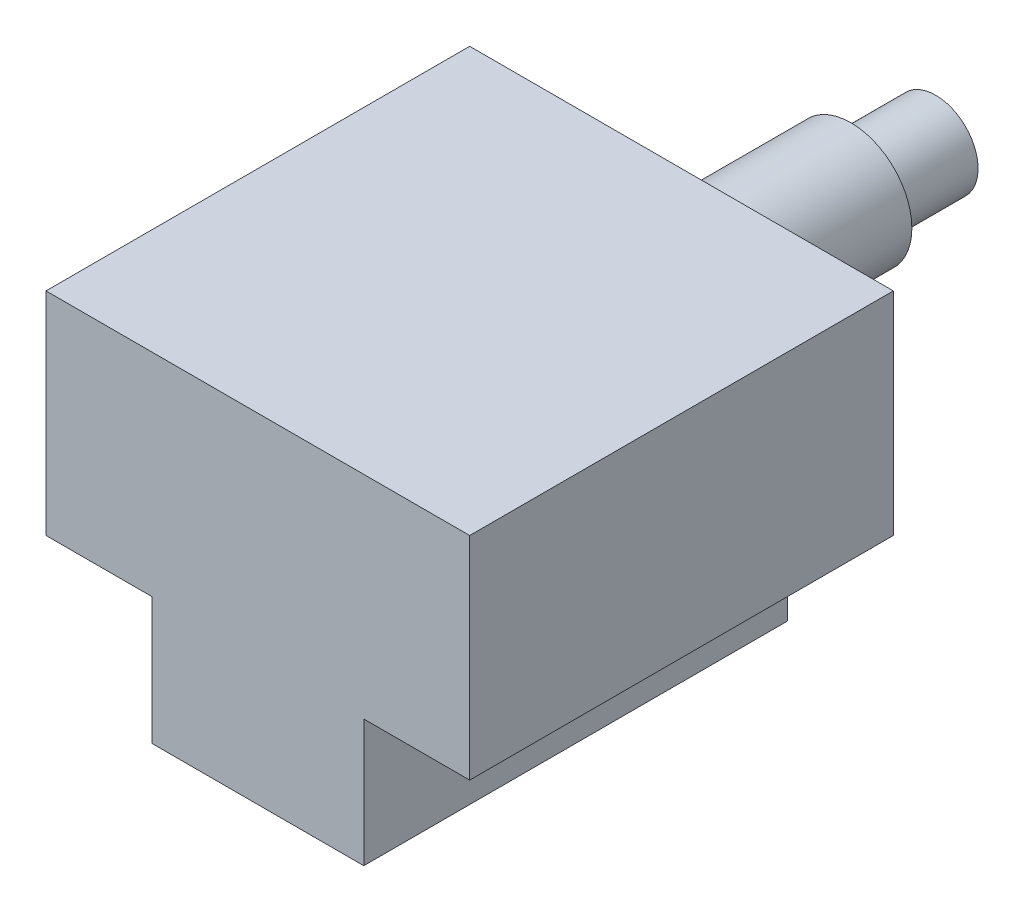
from build123d import *

# Parameters (mm, degrees)
SKETCH_1_W               = 100
SKETCH_1_H               = 50
SKETCH_1_W_2             = 50
SKETCH_1_H_2             = 30
EXTRUDE_1_DEPTH          = 50
SKETCH_2_R               = 14.373245618
EXTRUDE_2_DEPTH          = 30
CUT_EXTRUDE_2_DEPTH      = 154.378616502
CUT_EXTRUDE_2_DEPTH_BACK = 154.378616502
SKETCH_4_W               = 100
SKETCH_4_H               = 50
SKETCH_5_R               = 10
EXTRUDE_3_DEPTH          = 30
SKETCH_6_R               = 14.373245618
EXTRUDE_4_DEPTH          = 10


with BuildPart() as part:
    # 草图1 → 凸台-拉伸1 (new, symmetric)
    with BuildSketch(Plane.XY):
        Rectangle(SKETCH_1_W, SKETCH_1_H)
        with Locations((0, -40)):
            Rectangle(SKETCH_1_W_2, SKETCH_1_H_2)
        Polygon((25, -55), (-25, -55), (-50, -55), (-50, -105), (50, -105), (50, -55), align=None)
    extrude(amount=EXTRUDE_1_DEPTH, both=True)

    # 草图2 → 凸台-拉伸2 (add)
    with BuildSketch(Plane(origin=(0, 0, -50), x_dir=(-1, 0, 0), z_dir=(0, 0, -1))):
        with Locations(Location((0, 0, 0), (0, 0, 180))):
            Circle(SKETCH_2_R)
    extrude(amount=EXTRUDE_2_DEPTH)

    # 草图4 → 切除-拉伸2 (cut, two sides: drawn at the far end of the back side and taken through both)
    with BuildSketch(Plane(origin=(0, 0, -50), x_dir=(-1, 0, 0), z_dir=(0, 0, -1)).offset(-CUT_EXTRUDE_2_DEPTH_BACK)):
        with Locations((0, -80)):
            Rectangle(SKETCH_4_W, SKETCH_4_H)
    extrude(amount=CUT_EXTRUDE_2_DEPTH + CUT_EXTRUDE_2_DEPTH_BACK, mode=Mode.SUBTRACT)

    # 草图5 → 凸台-拉伸3 (add)
    with BuildSketch(Plane(origin=(0, 0, -80), x_dir=(-1, 0, 0), z_dir=(0, 0, -1))):
        Circle(SKETCH_5_R)
    extrude(amount=EXTRUDE_3_DEPTH)

    # 草图6 → 凸台-拉伸4 (add)
    with BuildSketch(Plane(origin=(0, 0, -80), x_dir=(-1, 0, 0), z_dir=(0, 0, -1))):
        with Locations(Location((0, 0, 0), (0, 0, 180))):
            Circle(SKETCH_6_R)
    extrude(amount=EXTRUDE_4_DEPTH)


solid = part.part
